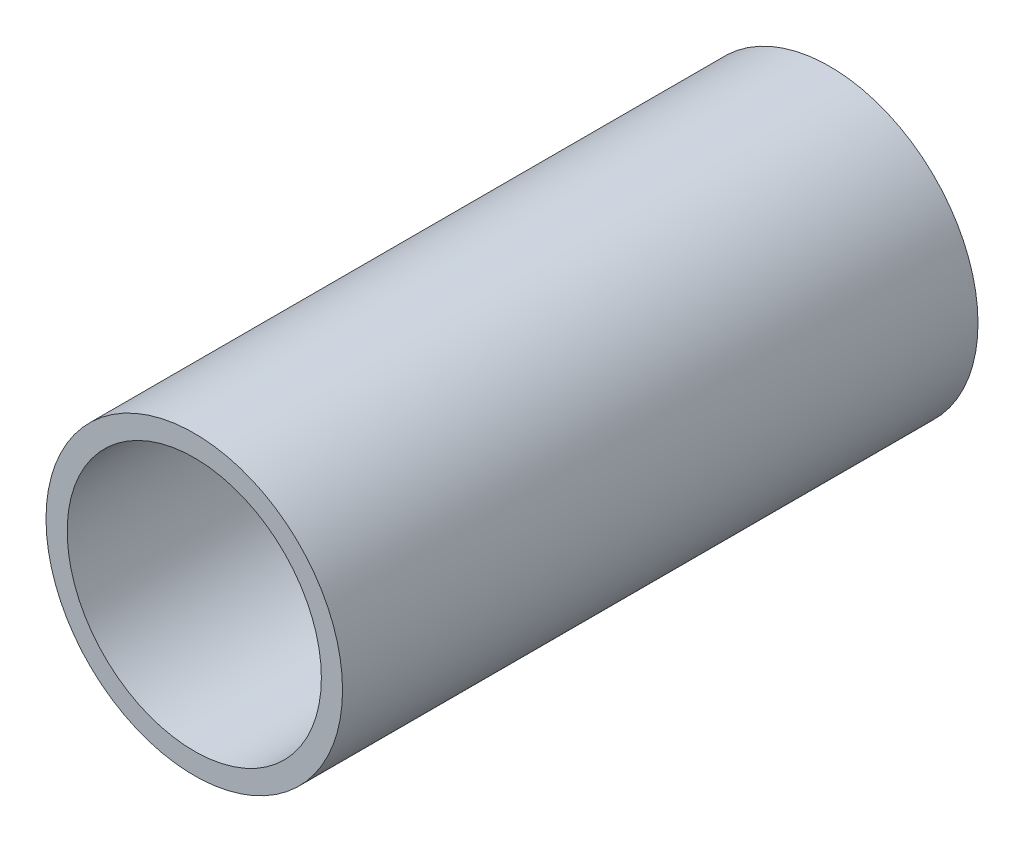
from build123d import *

# Parameters (mm, degrees)
SKETCH1_R           = 3.5
BOSS_EXTRUDE1_DEPTH = 15
SKETCH2_R           = 3
CUT_EXTRUDE1_DEPTH  = 15


with BuildPart() as part:
    # Sketch1 → Boss-Extrude1 (new body)
    with BuildSketch(Plane.XY):
        Circle(SKETCH1_R)
    extrude(amount=BOSS_EXTRUDE1_DEPTH)

    # Sketch2 → Cut-Extrude1 (cut)
    with BuildSketch(Plane.XY.offset(15)):
        Circle(SKETCH2_R)
    extrude(amount=-CUT_EXTRUDE1_DEPTH, mode=Mode.SUBTRACT)


solid = part.part
